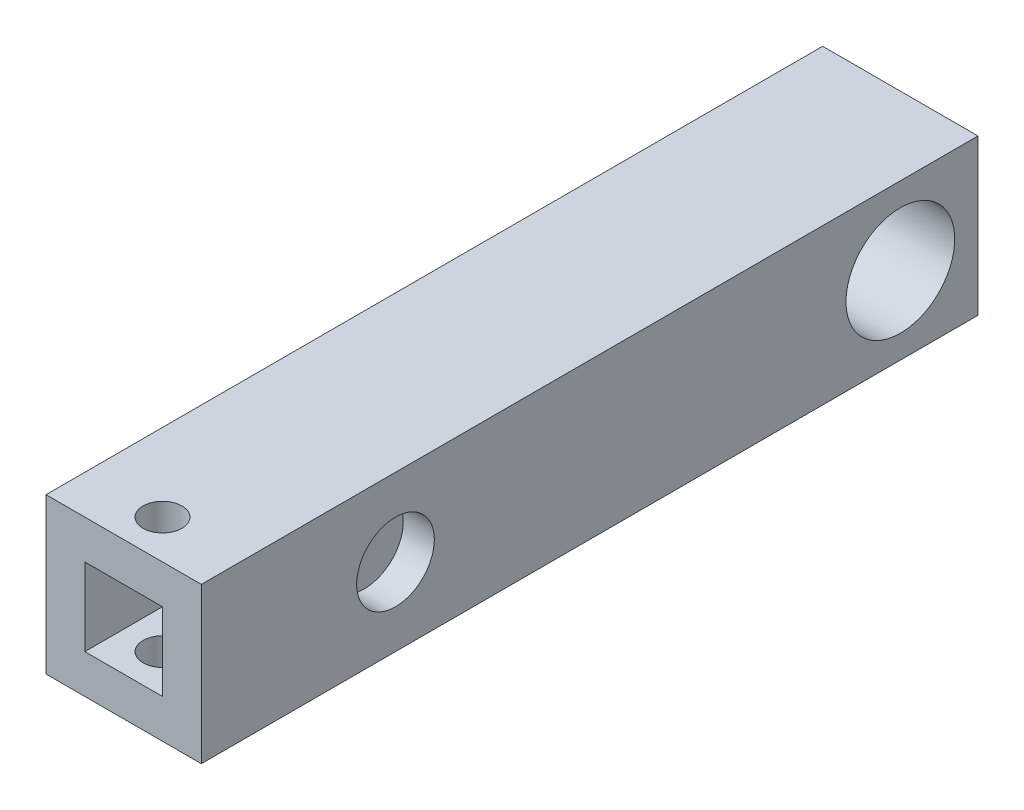
from build123d import *

# Parameters (mm, degrees)
SKETCH1_W               = 200
SKETCH1_H               = 200
BOSS_EXTRUDE1_DEPTH     = 1000
CUT_EXTRUDE1_DEPTH      = 100
CUT_EXTRUDE1_DEPTH_BACK = 300
SKETCH2_R               = 70
SKETCH3_W               = 100
SKETCH3_H               = 100
CUT_EXTRUDE2_DEPTH      = 100
CUT_EXTRUDE3_DEPTH      = 183
CUT_EXTRUDE3_DEPTH_BACK = 100
SKETCH4_R               = 25
SKETCH5_R               = 50
CUT_EXTRUDE4_DEPTH      = 40
CUT_EXTRUDE5_START      = -40
SKETCH6_R               = 50
CUT_EXTRUDE5_DEPTH      = 40


with BuildPart() as part:
    # Sketch1 → Boss-Extrude1 (new body)
    with BuildSketch(Plane.XY):
        Rectangle(SKETCH1_W, SKETCH1_H)
    extrude(amount=BOSS_EXTRUDE1_DEPTH)

    # Sketch2 → Cut-Extrude1 (cut, two sides: drawn at the far end of the back side and taken through both)
    with BuildSketch(Plane(origin=(100, 0, 0), x_dir=(0, 0, -1), z_dir=(1, 0, 0)).offset(-CUT_EXTRUDE1_DEPTH_BACK)):
        with Locations(Location((-100, 0, 0), (0, 0, 180))):
            Circle(SKETCH2_R)
    extrude(amount=CUT_EXTRUDE1_DEPTH + CUT_EXTRUDE1_DEPTH_BACK, mode=Mode.SUBTRACT)

    # Sketch3 → Cut-Extrude2 (cut)
    with BuildSketch(Plane.XY.offset(1000)):
        Rectangle(SKETCH3_W, SKETCH3_H)
    extrude(amount=-CUT_EXTRUDE2_DEPTH, mode=Mode.SUBTRACT)

    # Sketch4 → Cut-Extrude3 (cut, two sides: drawn at the far end of the back side and taken through both)
    with BuildSketch(Plane(origin=(0, -50, 0), x_dir=(1, 0, 0), z_dir=(0, 1, 0)).offset(-CUT_EXTRUDE3_DEPTH_BACK)):
        with Locations((0, -950)):
            Circle(SKETCH4_R)
    extrude(amount=CUT_EXTRUDE3_DEPTH + CUT_EXTRUDE3_DEPTH_BACK, mode=Mode.SUBTRACT)

    # Sketch5 → Cut-Extrude4 (cut)
    with BuildSketch(Plane(origin=(100, 0, 0), x_dir=(0, 0, -1), z_dir=(1, 0, 0))):
        with Locations((-750, 0)):
            Circle(SKETCH5_R)
    extrude(amount=-CUT_EXTRUDE4_DEPTH, mode=Mode.SUBTRACT)

    # Sketch6 → Cut-Extrude5 (cut)
    with BuildSketch(Plane.ZY.offset(100).offset(CUT_EXTRUDE5_START)):
        with Locations(Location((750, 0, 0), (0, 0, 180))):
            Circle(SKETCH6_R)
    extrude(amount=CUT_EXTRUDE5_DEPTH, mode=Mode.SUBTRACT)


solid = part.part
